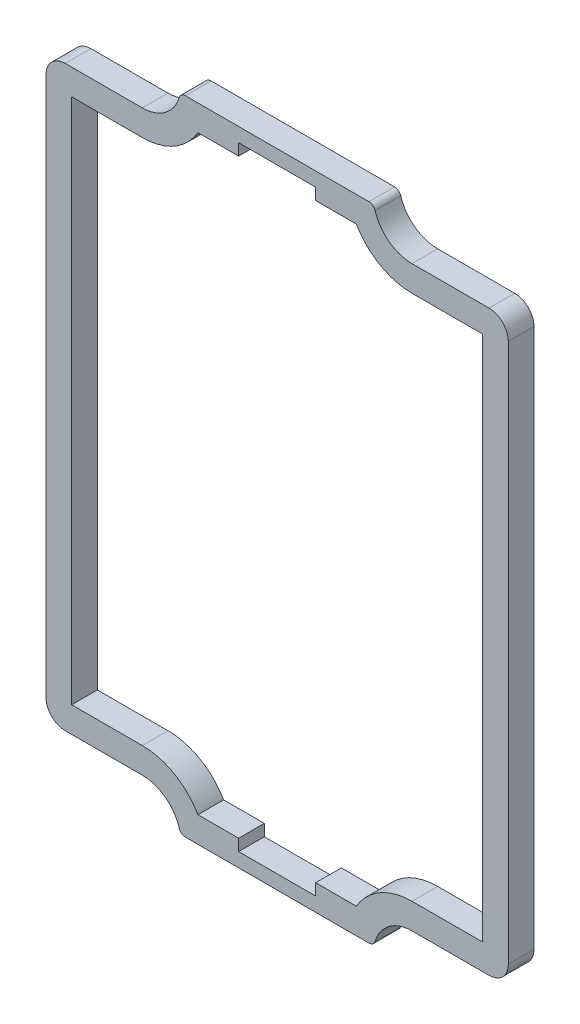
from build123d import *

# Parameters (mm, degrees)
BASE_EXTRUSION_DEPTH = 2


with BuildPart() as part:
    # Esquisse1 → Base-Extrusion (new body)
    with BuildSketch(Plane.XY):
        with BuildLine():
            Line((-16.5, -22.5), (-10.5, -22.5))
            ThreePointArc((-10.5, -22.5), (-8.707157086, -23.094648823), (-7.625055458, -24.642857143))
            ThreePointArc((-7.625055458, -24.642857143), (-7.444705186, -24.900891863), (-7.145898034, -25))
            Line((-7.145898034, -25), (7.145898034, -25))
            ThreePointArc((7.145898034, -25), (7.444705186, -24.900891863), (7.625055458, -24.642857143))
            ThreePointArc((7.625055458, -24.642857143), (8.707157086, -23.094648823), (10.5, -22.5))
            Line((10.5, -22.5), (16.5, -22.5))
            ThreePointArc((16.5, -22.5), (17.560660172, -22.060660172), (18, -21))
            Line((18, -21), (18, 21))
            ThreePointArc((18, 21), (17.560660172, 22.060660172), (16.5, 22.5))
            Line((16.5, 22.5), (10.5, 22.5))
            ThreePointArc((10.5, 22.5), (8.707157086, 23.094648823), (7.625055458, 24.642857143))
            ThreePointArc((7.625055458, 24.642857143), (7.444705186, 24.900891863), (7.145898034, 25))
            Line((7.145898034, 25), (-7.145898034, 25))
            ThreePointArc((-7.145898034, 25), (-7.444705186, 24.900891863), (-7.625055458, 24.642857143))
            ThreePointArc((-7.625055458, 24.642857143), (-8.707157086, 23.094648823), (-10.5, 22.5))
            Line((-10.5, 22.5), (-16.5, 22.5))
            ThreePointArc((-16.5, 22.5), (-17.560660172, 22.060660172), (-18, 21))
            Line((-18, 21), (-18, -21))
            ThreePointArc((-18, -21), (-17.560660172, -22.060660172), (-16.5, -22.5))
        make_face()
        with BuildLine():
            Line((-16, -20.5), (-10.5, -20.5))
            ThreePointArc((-10.5, -20.5), (-8, -21.169872981), (-6.169872981, -23))
            Line((-6.169872981, -23), (-3, -23))
            Line((-3, -23), (-3, -23.903020069))
            Line((-3, -23.903020069), (3, -23.903020069))
            Line((3, -23.903020069), (3, -23))
            Line((3, -23), (6.169872981, -23))
            ThreePointArc((6.169872981, -23), (8, -21.169872981), (10.5, -20.5))
            Line((10.5, -20.5), (16, -20.5))
            Line((16, -20.5), (16, 20.5))
            Line((16, 20.5), (10.5, 20.5))
            ThreePointArc((10.5, 20.5), (8, 21.169872981), (6.169872981, 23))
            Line((6.169872981, 23), (3, 23))
            Line((3, 23), (3, 23.903020069))
            Line((3, 23.903020069), (-3, 23.903020069))
            Line((-3, 23.903020069), (-3, 23))
            Line((-3, 23), (-6.169872981, 23))
            ThreePointArc((-6.169872981, 23), (-8, 21.169872981), (-10.5, 20.5))
            Line((-10.5, 20.5), (-16, 20.5))
            Line((-16, 20.5), (-16, -20.5))
        make_face(mode=Mode.SUBTRACT)
    extrude(amount=BASE_EXTRUSION_DEPTH)


solid = part.part
